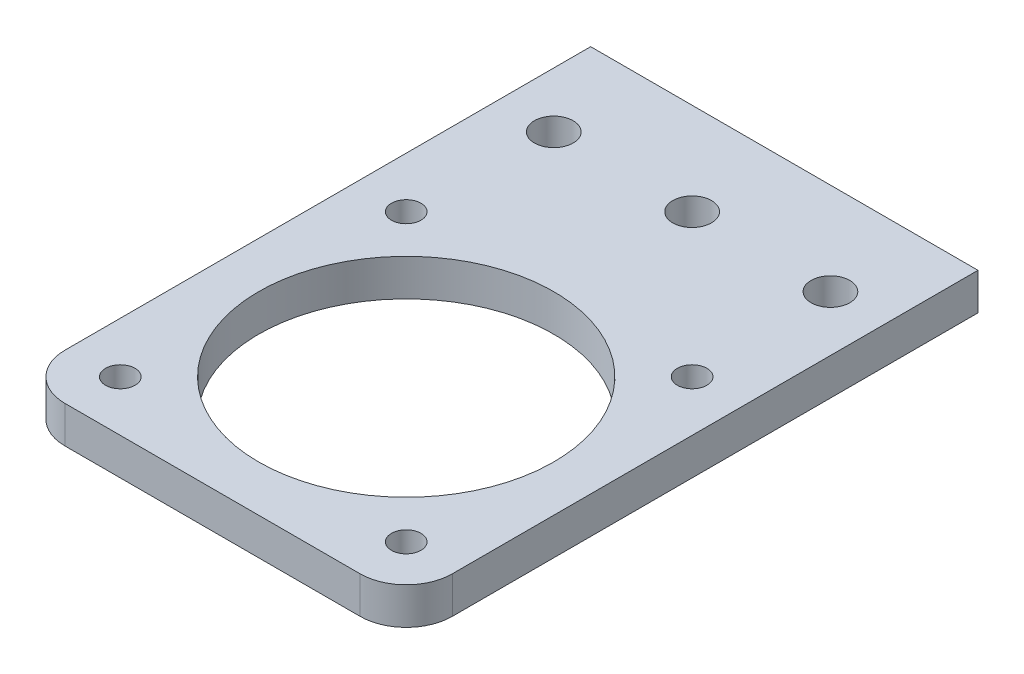
from build123d import *

# Parameters (mm, degrees)
SKETCH_1_R      = 1.6
SKETCH_1_R_2    = 16
SKETCH_1_R_3    = 2.1
EXTRUDE_1_DEPTH = 4


with BuildPart() as part:
    # 草图1 → 凸台-拉伸1 (new body)
    with BuildSketch(Plane(origin=(0, 0, 0), x_dir=(1, 0, 0), z_dir=(0, 1, 0))):
        with BuildLine():
            Line((0, 0), (42, 0))
            Line((42, 0), (42, -57))
            ThreePointArc((42, -57), (40.535533906, -60.535533906), (37, -62))
            Line((37, -62), (5, -62))
            ThreePointArc((5, -62), (1.464466094, -60.535533906), (0, -57))
            Line((0, -57), (0, 0))
        make_face()
        with Locations(Location((5.5, -25.5, 0), (0, 0, 270))):
            Circle(SKETCH_1_R, mode=Mode.SUBTRACT)
        with Locations(Location((36.5, -25.5, 0), (0, 0, 270))):
            Circle(SKETCH_1_R, mode=Mode.SUBTRACT)
        with Locations(Location((36.5, -56.5, 0), (0, 0, 270))):
            Circle(SKETCH_1_R, mode=Mode.SUBTRACT)
        with Locations(Location((5.5, -56.5, 0), (0, 0, 270))):
            Circle(SKETCH_1_R, mode=Mode.SUBTRACT)
        with Locations(Location((21, -41, 0), (0, 0, 270))):
            Circle(SKETCH_1_R_2, mode=Mode.SUBTRACT)
        with Locations(Location((21, -10, 0), (0, 0, 270))):
            Circle(SKETCH_1_R_3, mode=Mode.SUBTRACT)
        with Locations(Location((36, -10, 0), (0, 0, 270))):
            Circle(SKETCH_1_R_3, mode=Mode.SUBTRACT)
        with Locations(Location((6, -10, 0), (0, 0, 270))):
            Circle(SKETCH_1_R_3, mode=Mode.SUBTRACT)
    extrude(amount=EXTRUDE_1_DEPTH)


solid = part.part
